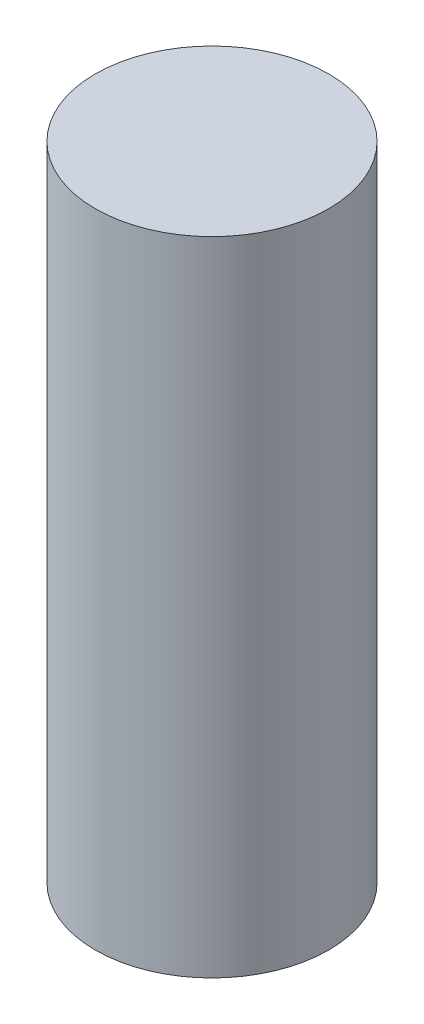
from build123d import *

# Parameters (mm, degrees)
SKETCH1_R           = 20.32
BOSS_EXTRUDE1_DEPTH = 111.76


with BuildPart() as part:
    # Sketch1 → Boss-Extrude1 (new body)
    with BuildSketch(Plane(origin=(0, 0, 0), x_dir=(1, 0, 0), z_dir=(0, 1, 0))):
        with Locations(Location((0, 0, 0), (0, 0, 270))):
            Circle(SKETCH1_R)
    extrude(amount=BOSS_EXTRUDE1_DEPTH)


solid = part.part
